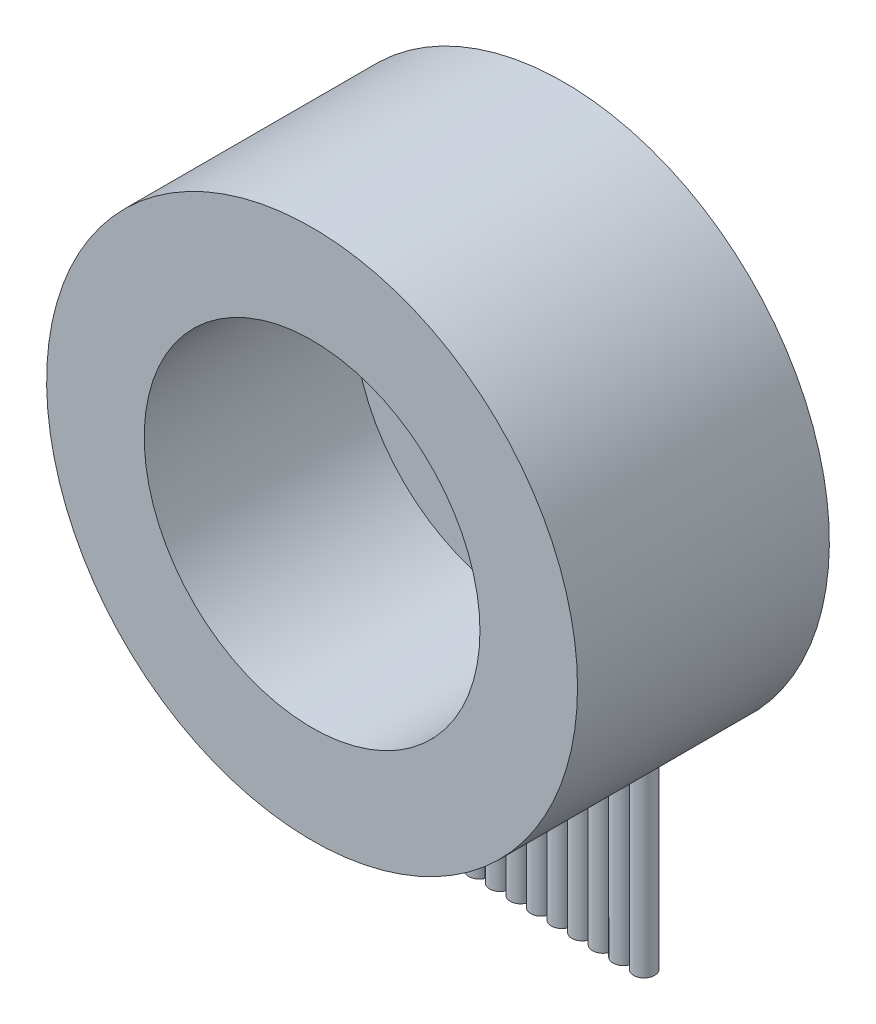
from build123d import *

# Parameters (mm, degrees)
SKETCH_1_R          = 12.65
EXTRUDE_1_DEPTH     = 12
CUT_EXTRUDE_START   = 9
CUT_EXTRUDE_1_DEPTH = 9
CUT_EXTRUDE_2_DEPTH = 0.5
EXTRUDE_5_DEPTH     = 10
SKETCH_4_R          = 8
CUT_EXTRUDE_3_DEPTH = 10
CUT_EXTRUDE_4_DEPTH = 1


with BuildPart() as part:
    # 草图1 → 凸台-拉伸1 (new body)
    with BuildSketch(Plane.XY):
        Circle(SKETCH_1_R)
    extrude(amount=EXTRUDE_1_DEPTH)

    # 草图2 → 切除-拉伸1 (cut)
    with BuildSketch(Plane(origin=(0, 0, 1), x_dir=(-1, 0, 0), z_dir=(0, 0, -1)).offset(CUT_EXTRUDE_START)):
        with BuildLine():
            Line((0, -11.379520841), (-5.525305913, -11.379520841))
            ThreePointArc((-5.525305913, -11.379520841), (0, -12.65), (5.525305913, -11.379520841))
            Line((5.525305913, -11.379520841), (0, -11.379520841))
        make_face()
    extrude(amount=-CUT_EXTRUDE_1_DEPTH, mode=Mode.SUBTRACT)

    # 草图2<2> → 切除-拉伸2 (cut)
    with BuildSketch(Plane(origin=(0, 0, 1), x_dir=(-1, 0, 0), z_dir=(0, 0, -1))):
        with BuildLine():
            Line((0, -11.379520841), (-5.525305913, -11.379520841))
            ThreePointArc((-5.525305913, -11.379520841), (0, -12.65), (5.525305913, -11.379520841))
            Line((5.525305913, -11.379520841), (0, -11.379520841))
        make_face()
    extrude(amount=-CUT_EXTRUDE_2_DEPTH, mode=Mode.SUBTRACT)

    # 草图3 → 凸台-拉伸5 (add)
    with BuildSketch(Plane.XZ.offset(11.379520841)):
        with BuildLine():
            Line((-4.052610832, 0.723255308), (-3.95666659, 0.723255308))
            ThreePointArc((-3.95666659, 0.723255308), (-3.5, 1.019648763), (-3.04333341, 0.723255308))
            Line((-3.04333341, 0.723255308), (-2.964929601, 0.723255308))
            ThreePointArc((-2.964929601, 0.723255308), (-2.5, 1.039297525), (-2.035070399, 0.723255308))
            Line((-2.035070399, 0.723255308), (-1.972231454, 0.723255308))
            ThreePointArc((-1.972231454, 0.723255308), (-1.5, 1.058946288), (-1.027768546, 0.723255308))
            Line((-1.027768546, 0.723255308), (-0.97861614, 0.723255308))
            ThreePointArc((-0.97861614, 0.723255308), (-0.5, 1.07859505), (-0.02138386, 0.723255308))
            Line((-0.02138386, 0.723255308), (0.01588005, 0.723255308))
            ThreePointArc((0.01588005, 0.723255308), (0.5, 1.098243813), (0.98411995, 0.723255308))
            Line((0.98411995, 0.723255308), (1.011227359, 0.723255308))
            ThreePointArc((1.011227359, 0.723255308), (1.5, 1.117892575), (1.988772641, 0.723255308))
            Line((1.988772641, 0.723255308), (2.007401669, 0.723255308))
            ThreePointArc((2.007401669, 0.723255308), (2.5, 1.137541338), (2.992598331, 0.723255308))
            Line((2.992598331, 0.723255308), (3.00438383, 0.723255308))
            ThreePointArc((3.00438383, 0.723255308), (3.5, 1.1571901), (3.99561617, 0.723255308))
            Line((3.99561617, 0.723255308), (4.002159148, 0.723255308))
            ThreePointArc((4.002159148, 0.723255308), (4.983765438, 0.803215289), (4.088469212, 0.392862789))
            Line((4.088469212, 0.392862789), (3.924418511, 0.392862789))
            ThreePointArc((3.924418511, 0.392862789), (3.5, 0.1571901), (3.075581489, 0.392862789))
            Line((3.075581489, 0.392862789), (2.93604175, 0.392862789))
            ThreePointArc((2.93604175, 0.392862789), (2.5, 0.137541338), (2.06395825, 0.392862789))
            Line((2.06395825, 0.392862789), (1.946499267, 0.392862789))
            ThreePointArc((1.946499267, 0.392862789), (1.5, 0.117892575), (1.053500733, 0.392862789))
            Line((1.053500733, 0.392862789), (0.955871292, 0.392862789))
            ThreePointArc((0.955871292, 0.392862789), (0.5, 0.098243813), (0.044128708, 0.392862789))
            Line((0.044128708, 0.392862789), (-0.035776425, 0.392862789))
            ThreePointArc((-0.035776425, 0.392862789), (-0.5, 0.07859505), (-0.964223575, 0.392862789))
            Line((-0.964223575, 0.392862789), (-1.028389704, 0.392862789))
            ThreePointArc((-1.028389704, 0.392862789), (-1.5, 0.058946288), (-1.971610296, 0.392862789))
            Line((-1.971610296, 0.392862789), (-2.021923784, 0.392862789))
            ThreePointArc((-2.021923784, 0.392862789), (-2.5, 0.039297525), (-2.978076216, 0.392862789))
            Line((-2.978076216, 0.392862789), (-3.016341735, 0.392862789))
            ThreePointArc((-3.016341735, 0.392862789), (-3.5, 0.019648763), (-3.983658265, 0.392862789))
            Line((-3.983658265, 0.392862789), (-4.01161325, 0.392862789))
            ThreePointArc((-4.01161325, 0.392862789), (-4.996194464, 0.438428468), (-4.052610832, 0.723255308))
        make_face()
    extrude(amount=EXTRUDE_5_DEPTH)

    # 草图4 → 切除-拉伸3 (cut)
    with BuildSketch(Plane.XY.offset(12)):
        Circle(SKETCH_4_R)
    extrude(amount=-CUT_EXTRUDE_3_DEPTH, mode=Mode.SUBTRACT)

    # 草图5 → 切除-拉伸4 (cut)
    with BuildSketch(Plane(origin=(0, 0, 0), x_dir=(-1, 0, 0), z_dir=(0, 0, -1))):
        with BuildLine():
            Line((-4.710329459, -10.815249292), (4.710329459, -10.815249292))
            ThreePointArc((4.710329459, -10.815249292), (0, 11.796474934), (-4.710329459, -10.815249292))
        make_face()
        with BuildLine():
            Line((-4.711523736, -10.812427627), (4.711523736, -10.812427627))
            ThreePointArc((4.711523736, -10.812427627), (0, 11.794365057), (-4.711523736, -10.812427627))
        make_face(mode=Mode.SUBTRACT)
    extrude(amount=-CUT_EXTRUDE_4_DEPTH, mode=Mode.SUBTRACT)


solid = part.part
